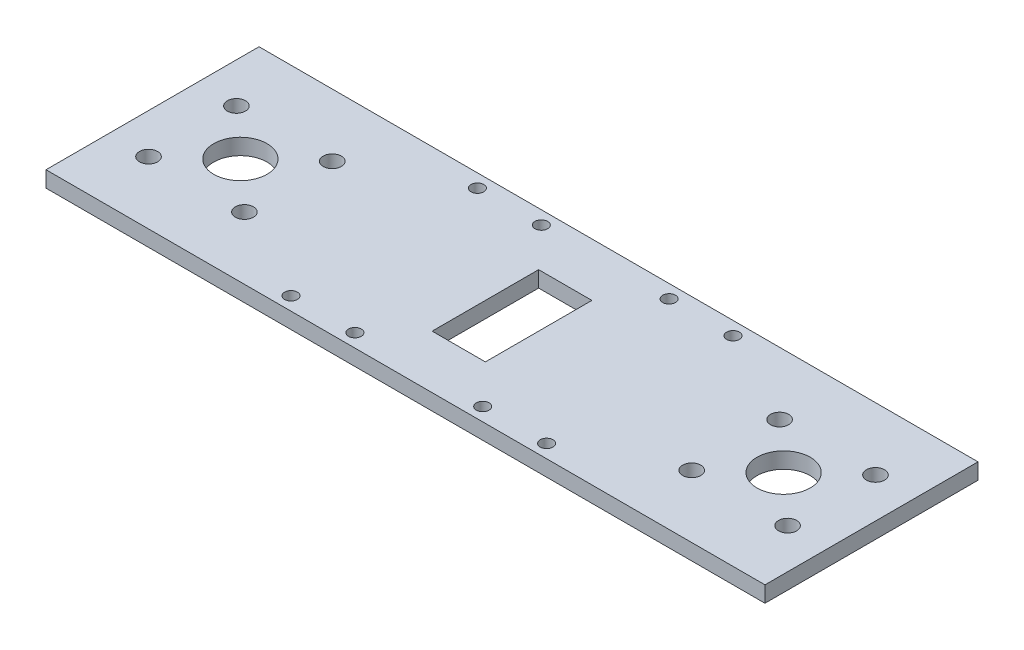
from build123d import *

# Parameters (mm, degrees)
SKETCH1_W           = 135
SKETCH1_H           = 40
SKETCH1_R           = 5
SKETCH1_R_2         = 1.7
SKETCH1_W_2         = 10
SKETCH1_H_2         = 20
BOSS_EXTRUDE1_DEPTH = 3
SKETCH3_R           = 1.2
CUT_EXTRUDE1_DEPTH  = 10


with BuildPart() as part:
    # Sketch1 → Boss-Extrude1 (new body)
    with BuildSketch(Plane(origin=(0, 0, 0), x_dir=(1, 0, 0), z_dir=(0, 1, 0))):
        Rectangle(SKETCH1_W, SKETCH1_H)
        with Locations(Location((-51, 0, 0), (0, 0, 270))):
            Circle(SKETCH1_R, mode=Mode.SUBTRACT)
        with Locations(Location((-60, 8.25, 0), (0, 0, 270))):
            Circle(SKETCH1_R_2, mode=Mode.SUBTRACT)
        with Locations(Location((-42, 8.25, 0), (0, 0, 270))):
            Circle(SKETCH1_R_2, mode=Mode.SUBTRACT)
        with Locations(Location((-42, -8.25, 0), (0, 0, 270))):
            Circle(SKETCH1_R_2, mode=Mode.SUBTRACT)
        with Locations(Location((-60, -8.25, 0), (0, 0, 270))):
            Circle(SKETCH1_R_2, mode=Mode.SUBTRACT)
        with Locations(Location((51, 0, 0), (0, 0, 90))):
            Circle(SKETCH1_R, mode=Mode.SUBTRACT)
        with Locations(Location((42, 8.25, 0), (0, 0, 90))):
            Circle(SKETCH1_R_2, mode=Mode.SUBTRACT)
        with Locations(Location((42, -8.25, 0), (0, 0, 90))):
            Circle(SKETCH1_R_2, mode=Mode.SUBTRACT)
        with Locations(Location((60, -8.25, 0), (0, 0, 90))):
            Circle(SKETCH1_R_2, mode=Mode.SUBTRACT)
        with Locations(Location((60, 8.25, 0), (0, 0, 90))):
            Circle(SKETCH1_R_2, mode=Mode.SUBTRACT)
        Rectangle(SKETCH1_W_2, SKETCH1_H_2, mode=Mode.SUBTRACT)
    extrude(amount=BOSS_EXTRUDE1_DEPTH)

    # Sketch3 → Cut-Extrude1 (cut)
    with BuildSketch(Plane(origin=(0, 3, 0), x_dir=(1, 0, 0), z_dir=(0, 1, 0))):
        with Locations(Location((-12, 17.5, 0), (0, 0, 270))):
            Circle(SKETCH3_R)
        with Locations(Location((-12, -17.5, 0), (0, 0, 270))):
            Circle(SKETCH3_R)
        with Locations(Location((-24, 17.5, 0), (0, 0, 270))):
            Circle(SKETCH3_R)
        with Locations(Location((-24, -17.5, 0), (0, 0, 270))):
            Circle(SKETCH3_R)
        with Locations(Location((24, -17.5, 0), (0, 0, 270))):
            Circle(SKETCH3_R)
        with Locations(Location((24, 17.5, 0), (0, 0, 270))):
            Circle(SKETCH3_R)
        with Locations(Location((12, -17.5, 0), (0, 0, 270))):
            Circle(SKETCH3_R)
        with Locations(Location((12, 17.5, 0), (0, 0, 270))):
            Circle(SKETCH3_R)
    extrude(amount=-CUT_EXTRUDE1_DEPTH, mode=Mode.SUBTRACT)


solid = part.part
